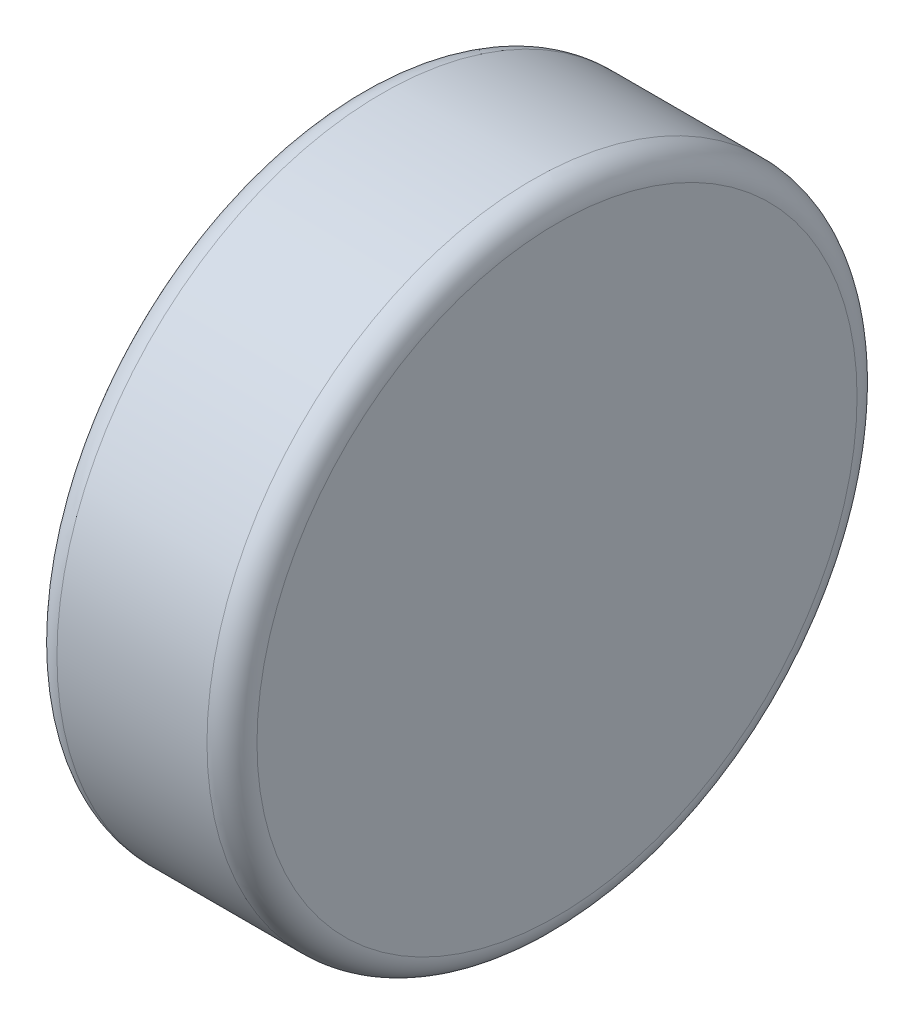
from build123d import *

# Parameters (mm, degrees)
SKETCH1_W = 101.6
SKETCH1_H = 165.1
FILLET1_R = 12.7


with BuildPart() as part:
    # Sketch1 → Revolve1 (revolve)
    with BuildSketch(Plane.XY, mode=Mode.PRIVATE) as revolve1_sk:
        with Locations((50.8, 82.55)):
            Rectangle(SKETCH1_W, SKETCH1_H)
    revolve(revolve1_sk.sketch.rotate(Axis((0, 0, 0), (1, 0, 0)), 90), axis=Axis((0, 0, 0), (1, 0, 0)))

    # Fillet1
    fillet1_edges = [part.edges().sort_by_distance(p)[0] for p in [
        (101.6, 0, -165.1),
        (0, 0, -165.1),
    ]]
    fillet(fillet1_edges, radius=FILLET1_R)


solid = part.part
